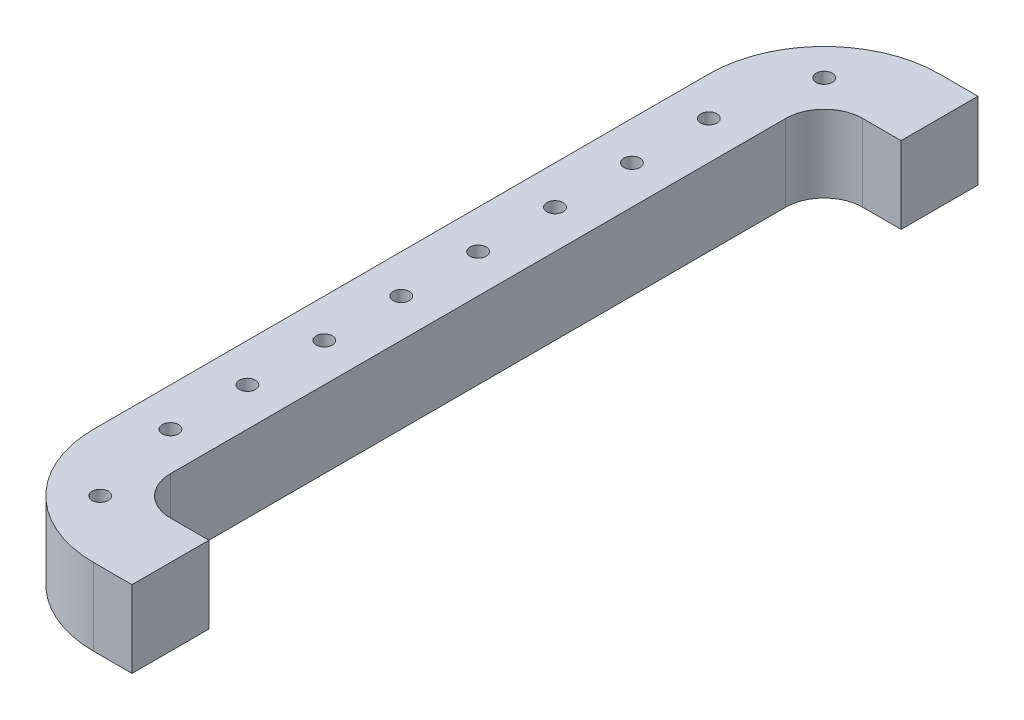
from build123d import *

# Parameters (mm, degrees)
BOSS_EXTRUDE1_DEPTH = 10
SKETCH3_W           = 20
SKETCH3_H           = 70
BOSS_EXTRUDE2_DEPTH = 20
SKETCH2_R           = 2.1
CUT_EXTRUDE1_DEPTH  = 79.74007874


with BuildPart() as part:
    # Sketch1 → Boss-Extrude1 (new, symmetric)
    with BuildSketch(Plane(origin=(0, 0, 0), x_dir=(1, 0, 0), z_dir=(0, 1, 0))):
        with BuildLine():
            Line((10, 0), (10, 10))
            ThreePointArc((10, 10), (12.928932188, 17.071067812), (20, 20))
            Line((20, 20), (30, 20))
            Line((30, 20), (30, 40))
            Line((30, 40), (20, 40))
            ThreePointArc((20, 40), (-1.213203436, 31.213203436), (-10, 10))
            Line((-10, 10), (-10, 0))
            Line((-10, 0), (10, 0))
        make_face()
    extrude(amount=BOSS_EXTRUDE1_DEPTH, both=True)

    # Sketch3 → Boss-Extrude2 (add)
    with BuildSketch(Plane(origin=(0, 10, 0), x_dir=(1, 0, 0), z_dir=(0, 1, 0))):
        with Locations((0, -35)):
            Rectangle(SKETCH3_W, SKETCH3_H)
    extrude(amount=-BOSS_EXTRUDE2_DEPTH)

    # Sketch2 → Cut-Extrude1 (cut, through all)
    with BuildSketch(Plane(origin=(0, 10, 0), x_dir=(1, 0, 0), z_dir=(0, 1, 0))):
        with Locations(Location((5.857864376, 24.142135624, 0), (0, 0, 270))):
            Circle(SKETCH2_R)
        with Locations(Location((0, -40, 0), (0, 0, 270))):
            Circle(SKETCH2_R)
        with Locations((70, 30)):
            Circle(SKETCH2_R)
        with Locations(Location((0, -60, 0), (0, 0, 270))):
            Circle(SKETCH2_R)
        with Locations(Location((0, -20, 0), (0, 0, 270))):
            Circle(SKETCH2_R)
        with Locations(Location((0, 0, 0), (0, 0, 270))):
            Circle(SKETCH2_R)
    extrude(amount=-CUT_EXTRUDE1_DEPTH, mode=Mode.SUBTRACT)

    # Mirror1: part across plane


with BuildPart() as part_1:
    add(part.part)
    add(part.part.mirror(Plane(origin=(10, -82.801098893, 70), x_dir=(1, 0, 0), z_dir=(0, 0, 1))))


solid = part_1.part
